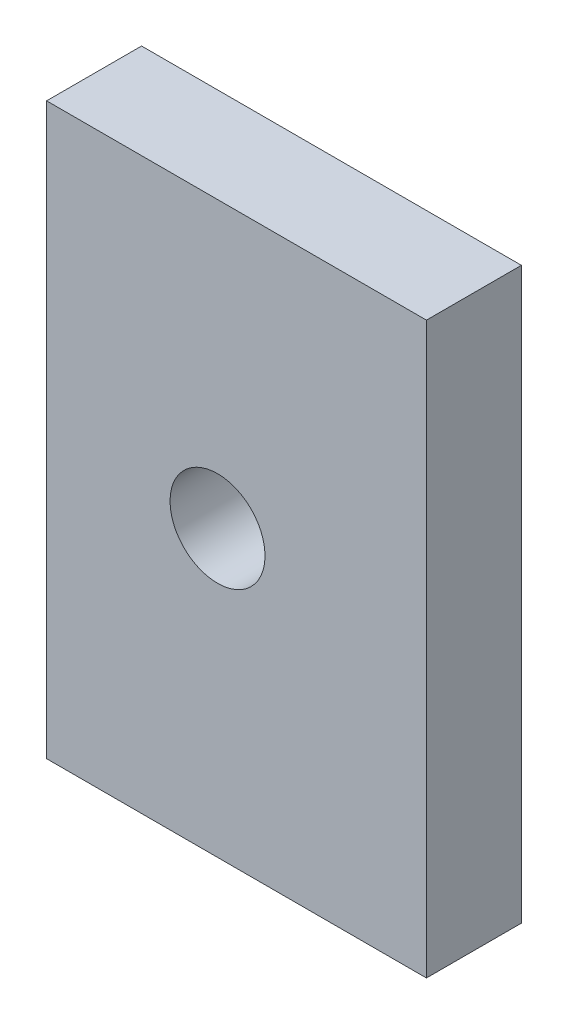
from build123d import *

# Parameters (mm, degrees)
SKETCH1_W               = 20
SKETCH1_H               = 30
BOSS_EXTRUDE1_DEPTH     = 5
CUT_EXTRUDE1_DEPTH      = 12
CUT_EXTRUDE1_DEPTH_BACK = 9
SKETCH2_R               = 2.5


with BuildPart() as part:
    # Sketch1 → Boss-Extrude1 (new body)
    with BuildSketch(Plane.XY):
        Rectangle(SKETCH1_W, SKETCH1_H)
    extrude(amount=BOSS_EXTRUDE1_DEPTH)

    # Sketch2 → Cut-Extrude1 (cut, two sides: drawn at the far end of the back side and taken through both)
    with BuildSketch(Plane.XY.offset(5).offset(-CUT_EXTRUDE1_DEPTH_BACK)):
        with Locations(Location((-1, 0, 0), (0, 0, 180))):
            Circle(SKETCH2_R)
    extrude(amount=CUT_EXTRUDE1_DEPTH + CUT_EXTRUDE1_DEPTH_BACK, mode=Mode.SUBTRACT)


solid = part.part
